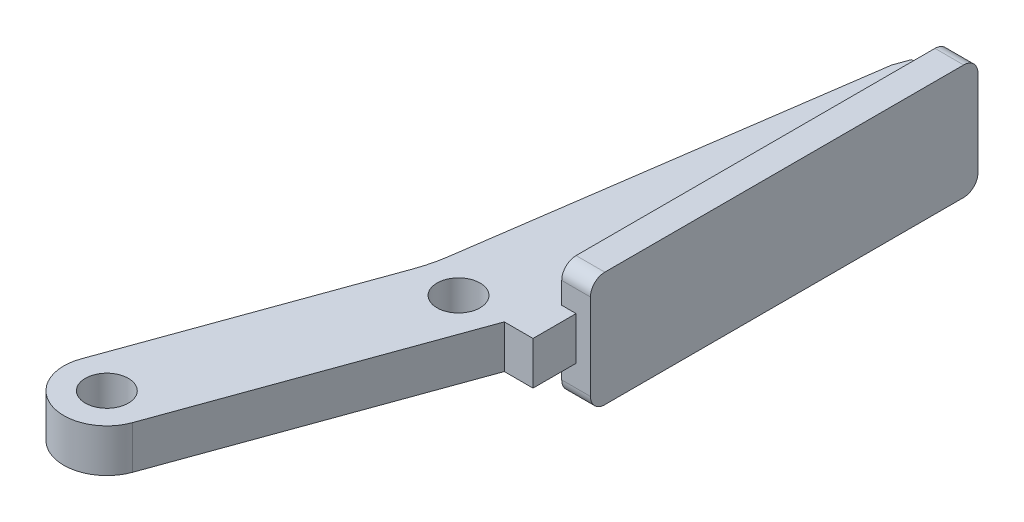
from build123d import *

# Parameters (mm, degrees)
SKETCH1_R           = 1.5
BOSS_EXTRUDE1_DEPTH = 1.5
SKETCH3_W           = 2
SKETCH3_H           = 27
BOSS_EXTRUDE2_DEPTH = 4
FILLET1_R           = 1


with BuildPart() as part:
    # Sketch1 → Boss-Extrude1 (new, symmetric)
    with BuildSketch(Plane(origin=(0, 0, 0), x_dir=(1, 0, 0), z_dir=(0, 1, 0))):
        with BuildLine():
            Line((-2.821661699, 1.018933391), (3.310390132, 18))
            ThreePointArc((3.310390132, 18), (3.606995734, 18.973968595), (3.803029904, 19.973048328))
            Line((3.803029904, 19.973048328), (7.689609868, 47))
            Line((7.689609868, 47), (8.050720979, 48))
            Line((8.050720979, 48), (11.689609868, 48))
            Line((11.689609868, 48), (11.689609868, 18))
            Line((11.689609868, 18), (9.689609868, 18))
            Line((9.689609868, 18), (2.821661699, -1.018933391))
            ThreePointArc((2.821661699, -1.018933391), (-1.018933391, -2.821661699), (-2.821661699, 1.018933391))
        make_face()
        with Locations(Location((6.5, 18, 0), (0, 0, 270))):
            Circle(SKETCH1_R, mode=Mode.SUBTRACT)
        with Locations(Location((0, 0, 0), (0, 0, 270))):
            Circle(SKETCH1_R, mode=Mode.SUBTRACT)
    extrude(amount=BOSS_EXTRUDE1_DEPTH, both=True)

    # Sketch3 → Boss-Extrude2 (add, symmetric)
    with BuildSketch(Plane(origin=(0, 0, 0), x_dir=(1, 0, 0), z_dir=(0, 1, 0))):
        with Locations((11.689609868, 34.5)):
            Rectangle(SKETCH3_W, SKETCH3_H)
    extrude(amount=BOSS_EXTRUDE2_DEPTH, both=True)

    # Fillet1
    fillet1_edges = [part.edges().sort_by_distance(p)[0] for p in [
        (11.689609868, -4, -48),
        (11.689609868, -4, -21),
        (11.689609868, 4, -48),
        (11.689609868, 4, -21),
    ]]
    fillet(fillet1_edges, radius=FILLET1_R)


solid = part.part
